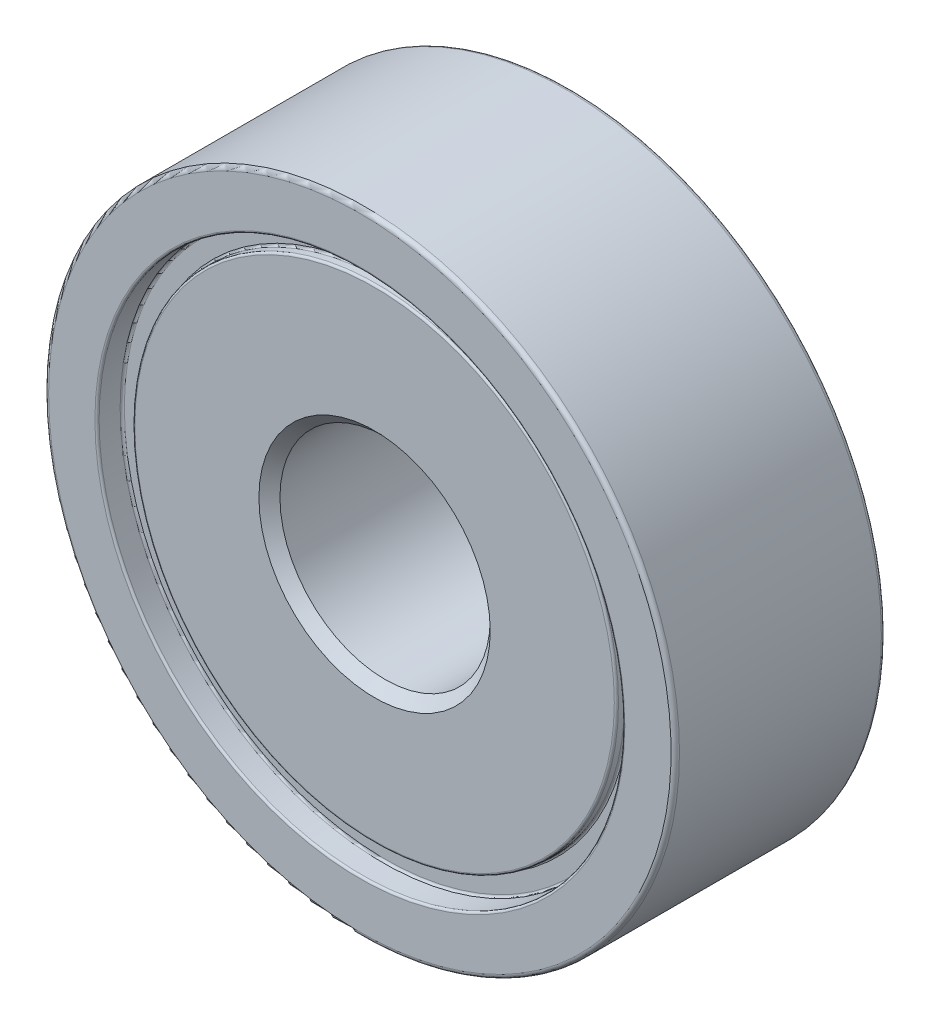
from build123d import *

# Parameters (mm, degrees)
FILLET1_R     = 0.01
CHAMFER1_SIZE = 0.05
FILLET2_R     = 0.02


with BuildPart() as part:
    # Sketch1 → Revolve1 (revolve)
    with BuildSketch(Plane(origin=(0, 0, 0), x_dir=(0, 0, -1), z_dir=(1, 0, 0)), mode=Mode.PRIVATE) as revolve1_sk:
        Polygon((0.07, 0.5), (0.07, 1.15), (0.12, 1.15), (0.12, 1.25), (0, 1.25), (0, 1.5), (1, 1.5), (1, 1.25), (0.88, 1.25), (0.88, 1.15), (0.93, 1.15), (0.93, 0.5), align=None)
    revolve(revolve1_sk.sketch.rotate(Axis((0, 0, 145.972624196), (0, 0, -1)), 90), axis=Axis((0, 0, 145.972624196), (0, 0, -1)))

    # Fillet1
    fillet1_edges = [part.edges().sort_by_distance(p)[0] for p in [
        (-1.25, 0, -1),
        (-1.25, 0, 0),
        (-1.25, 0, -0.12),
        (-1.15, 0, -0.12),
        (-1.15, 0, -0.07),
        (-1.15, 0, -0.93),
        (-1.15, 0, -0.88),
        (-1.25, 0, -0.88),
    ]]
    fillet(fillet1_edges, radius=FILLET1_R)

    # Chamfer1
    chamfer1_edges = [part.edges().sort_by_distance(p)[0] for p in [
        (-0.5, 0, -0.07),
        (-0.5, 0, -0.93),
    ]]
    chamfer(chamfer1_edges, length=CHAMFER1_SIZE)

    # Fillet2
    fillet2_edges = [part.edges().sort_by_distance(p)[0] for p in [
        (-1.5, 0, -1),
        (-1.5, 0, 0),
    ]]
    fillet(fillet2_edges, radius=FILLET2_R)


solid = part.part
